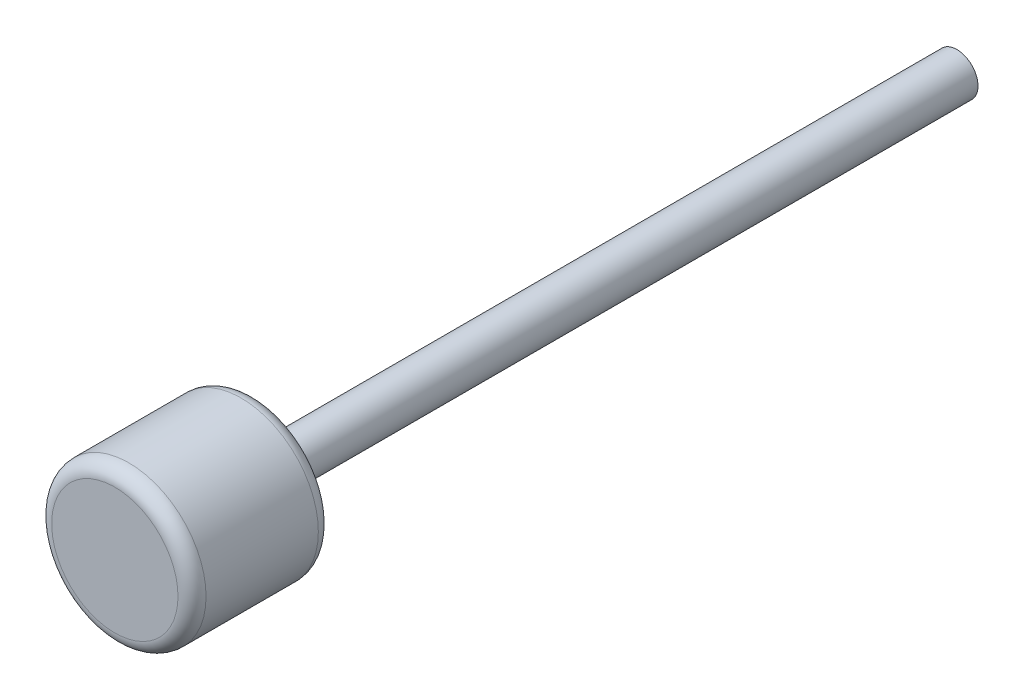
from build123d import *

# Parameters (mm, degrees)
SKETCH1_R           = 1.5
BOSS_EXTRUDE1_DEPTH = 50
SKETCH2_R           = 5.5
BOSS_EXTRUDE2_DEPTH = 10
FILLET1_R           = 1


with BuildPart() as part:
    # Sketch1 → Boss-Extrude1 (new body)
    with BuildSketch(Plane.XY):
        with Locations((0, 12.02081528)):
            Circle(SKETCH1_R)
    extrude(amount=BOSS_EXTRUDE1_DEPTH)

    # Sketch2 → Boss-Extrude2 (add)
    with BuildSketch(Plane.XY.offset(50)):
        with Locations((0, 12.02081528)):
            Circle(SKETCH2_R)
    extrude(amount=BOSS_EXTRUDE2_DEPTH)

    # Fillet1
    fillet1_edges = [part.edges().sort_by_distance(p)[0] for p in [
        (-5.5, 12.02081528, 50),
        (-5.5, 12.02081528, 60),
    ]]
    fillet(fillet1_edges, radius=FILLET1_R)


solid = part.part
